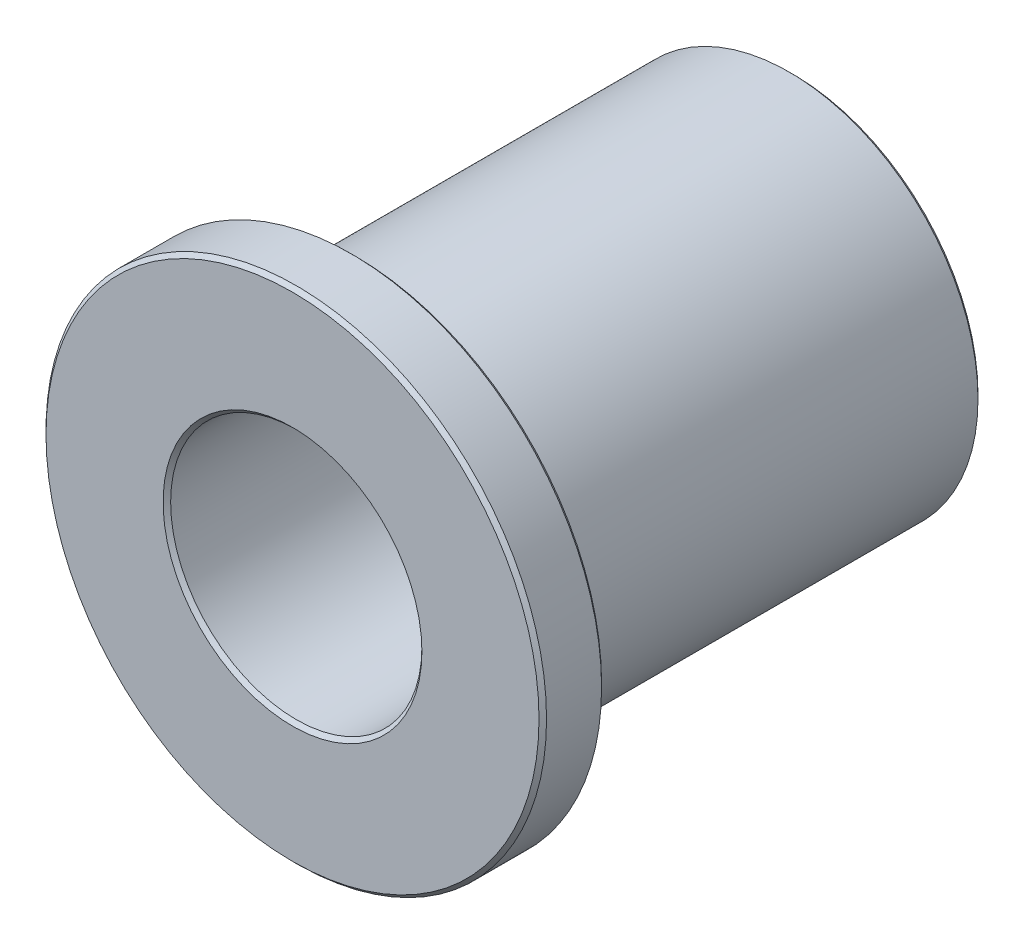
from build123d import *

# Parameters (mm, degrees)
BOSS_EXTRUDE1_START = 6.35
SKETCH3_R           = 6.35
SKETCH3_R_2         = 3.1877
BOSS_EXTRUDE1_DEPTH = 1.5875
BOSS_EXTRUDE2_START = 4.7625
SKETCH4_R           = 4.7879
SKETCH4_R_2         = 3.1877
BOSS_EXTRUDE2_DEPTH = 11.1125
CHAMFER1_SIZE       = 0.095631


with BuildPart() as part:
    # Sketch3 → Boss-Extrude1 (new body)
    with BuildSketch(Plane.XY.offset(BOSS_EXTRUDE1_START)):
        Circle(SKETCH3_R)
        Circle(SKETCH3_R_2, mode=Mode.SUBTRACT)
    extrude(amount=-BOSS_EXTRUDE1_DEPTH)

    # Sketch4 → Boss-Extrude2 (add)
    with BuildSketch(Plane.XY.offset(BOSS_EXTRUDE2_START)):
        Circle(SKETCH4_R)
        Circle(SKETCH4_R_2, mode=Mode.SUBTRACT)
    extrude(amount=-BOSS_EXTRUDE2_DEPTH)

    # Chamfer1
    chamfer1_edges = [part.edges().sort_by_distance(p)[0] for p in [
        (-3.1877, 0, -6.35),
        (-4.7879, 0, 4.7625),
        (-6.35, 0, 6.35),
        (-6.35, 0, 4.7625),
        (-3.1877, 0, 6.35),
        (-4.7879, 0, -6.35),
    ]]
    chamfer(chamfer1_edges, length=CHAMFER1_SIZE)


solid = part.part
